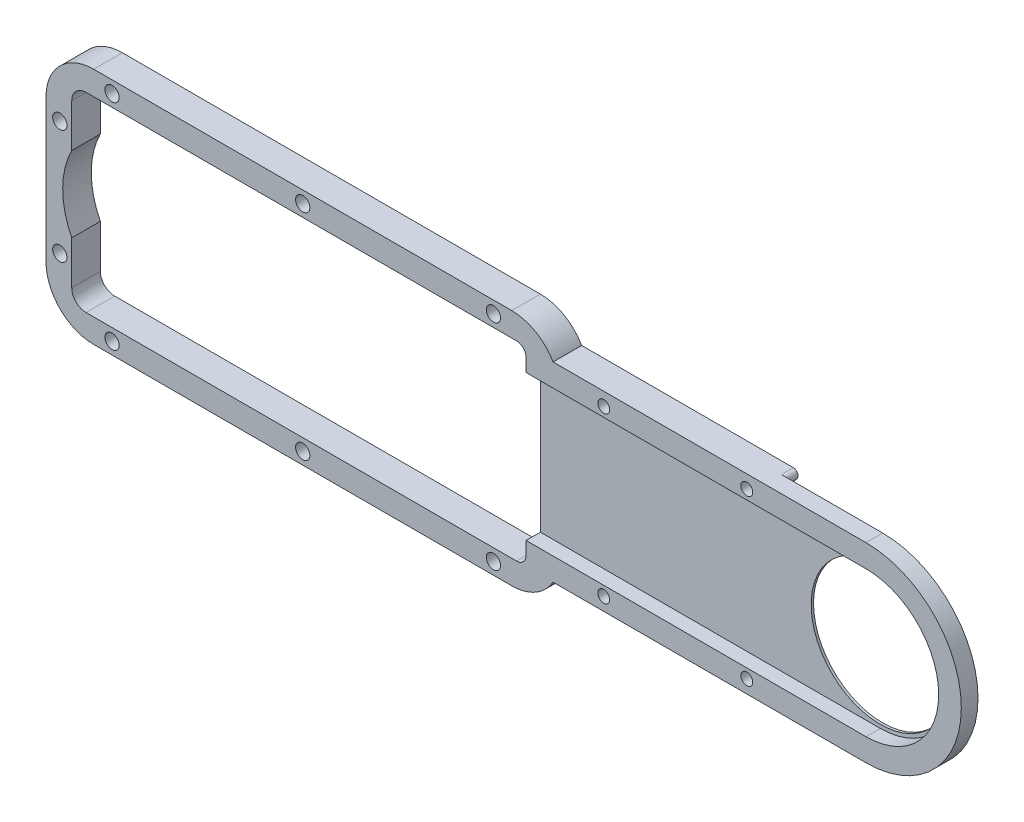
from build123d import *

# Parameters (mm, degrees)
BOSS_EXTRUDE1_DEPTH       = 6
CUT_EXTRUDE1_DEPTH        = 102.003801713
CUT_EXTRUDE2_DEPTH        = 3
F_2_CLEARANCE_HOLE1_D     = 2.5
F_1_1_8_CLEARANCE_HOLE1_D = 29
F_3_CLEARANCE_HOLE1_D     = 3
FILLET1_R                 = 2
FILLET2_R                 = 3
FILLET3_R                 = 10
SKETCH10_R                = 27.5
CUT_EXTRUDE3_DEPTH        = 2.5
FILLET4_R                 = 1


with BuildPart() as part:
    # Sketch1 → Boss-Extrude1 (new body)
    with BuildSketch(Plane.XY.offset(6)):
        with BuildLine():
            Line((74.569864729, 20.944878138), (8.930118766, 20.944878138))
            ThreePointArc((8.930118766, 20.944878138), (5.269864729, 24.605132176), (0.269864729, 25.944878138))
            Line((0.269864729, 25.944878138), (-97.430135271, 25.944878138))
            Line((-97.430135271, 25.944878138), (-97.430135271, -24.055121862))
            Line((-97.430135271, -24.055121862), (0.269864729, -24.055121862))
            ThreePointArc((0.269864729, -24.055121862), (5.269864729, -22.7153759), (8.930118767, -19.055121862))
            Line((8.930118767, -19.055121862), (74.569864729, -19.055121862))
            ThreePointArc((74.569864729, -19.055121862), (94.569864729, 0.944878138), (74.569864729, 20.944878138))
        make_face()
    extrude(amount=-BOSS_EXTRUDE1_DEPTH)

    # Sketch2 → Cut-Extrude1 (cut, through all)
    with BuildSketch(Plane(origin=(0, 0, 0), x_dir=(-1, 0, 0), z_dir=(0, 0, -1))):
        with BuildLine():
            Line((92.030135271, 20.944878138), (-3.269864729, 20.944878138))
            Line((-3.269864729, 20.944878138), (-3.269864729, -19.055121862))
            Line((-3.269864729, -19.055121862), (92.030135271, -19.055121862))
            Line((92.030135271, -19.055121862), (92.030135271, -6.985443419))
            ThreePointArc((92.030135271, -6.985443419), (93.930135271, 0.944878138), (92.030135271, 8.875199695))
            Line((92.030135271, 8.875199695), (92.030135271, 20.944878138))
        make_face()
    extrude(amount=-CUT_EXTRUDE1_DEPTH, mode=Mode.SUBTRACT)

    # Sketch3 → Cut-Extrude2 (cut)
    with BuildSketch(Plane.XY.offset(6)):
        with BuildLine():
            Line((74.569864729, 16.194878138), (3.269864729, 16.194878138))
            Line((3.269864729, 16.194878138), (3.269864729, -14.305121862))
            Line((3.269864729, -14.305121862), (74.569864729, -14.305121862))
            ThreePointArc((74.569864729, -14.305121862), (89.819864729, 0.944878138), (74.569864729, 16.194878138))
        make_face()
    extrude(amount=-CUT_EXTRUDE2_DEPTH, mode=Mode.SUBTRACT)

    # #2 Clearance Hole1 (through all)
    with Locations(Plane.XY.offset(6)):
        with Locations((49.569864729, 18.194878138), (19.569864729, -16.305121862), (19.569864729, 18.194878138), (49.569864729, -16.305121862)):
            Hole(F_2_CLEARANCE_HOLE1_D / 2)

    # 1-1/8 Clearance Hole1 (through all)
    with Locations(Plane.XY.offset(3)):
        with Locations((74.569864729, 0.944878138)):
            Hole(F_1_1_8_CLEARANCE_HOLE1_D / 2)

    # #3 Clearance Hole1 (through all)
    with Locations(Plane.XY.offset(6)):
        with Locations((-3.580135271, 23.444878138), (-43.580135271, 23.444878138), (-83.580135271, 23.444878138), (-94.530135271, 12.944878138), (-94.530135271, -11.055121862), (-43.580135271, -21.555121862), (-3.580135271, -21.555121862), (-83.580135271, -21.555121862)):
            Hole(F_3_CLEARANCE_HOLE1_D / 2)

    # Fillet1
    fillet1_edges = [part.edges().sort_by_distance(p)[0] for p in [
        (3.269864729, -19.055121862, 3),
        (3.269864729, 20.944878138, 3),
    ]]
    fillet(fillet1_edges, radius=FILLET1_R)

    # Fillet2
    fillet2_edges = [part.edges().sort_by_distance(p)[0] for p in [
        (-92.030135271, 20.944878138, 3),
        (-92.030135271, -19.055121862, 3),
    ]]
    fillet(fillet2_edges, radius=FILLET2_R)

    # Fillet3
    fillet3_edges = [part.edges().sort_by_distance(p)[0] for p in [
        (-97.430135271, -24.055121862, 3),
        (-97.430135271, 25.944878138, 3),
    ]]
    fillet(fillet3_edges, radius=FILLET3_R)

    # Sketch10 → Cut-Extrude3 (cut)
    with BuildSketch(Plane(origin=(0, 0, 0), x_dir=(-1, 0, 0), z_dir=(0, 0, -1))):
        with Locations((-74.569864729, 0.944878138)):
            Circle(SKETCH10_R)
    extrude(amount=-CUT_EXTRUDE3_DEPTH, mode=Mode.SUBTRACT)

    # Fillet4
    fillet4_edges = [part.edges().sort_by_distance(p)[0] for p in [
        (55.695278641, -19.055121862, 1.25),
        (55.695278641, 20.944878138, 1.25),
    ]]
    fillet(fillet4_edges, radius=FILLET4_R)


solid = part.part
